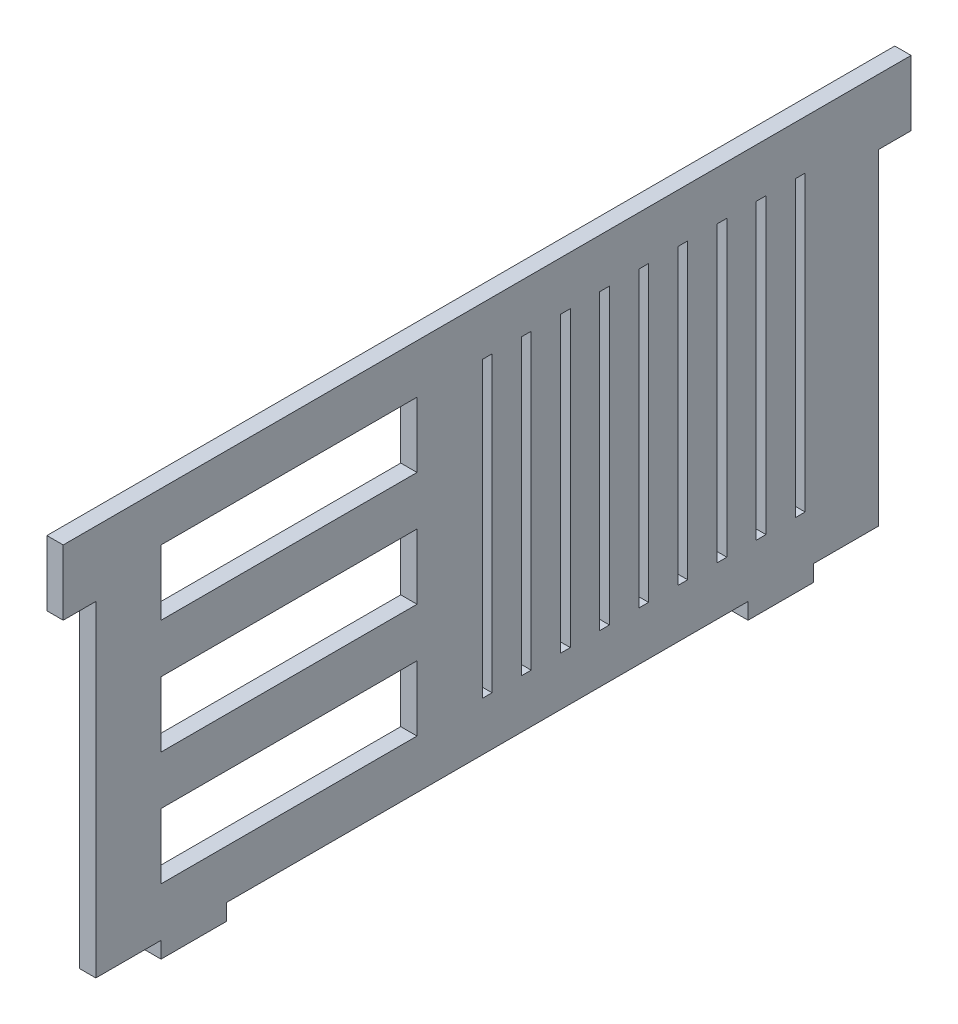
from build123d import *

# Parameters (mm, degrees)
SKIZZE2_W                       = 240
SKIZZE2_H                       = 120
SKIZZE2_W_2                     = 10
SKIZZE2_H_2                     = 20
SKIZZE2_W_3                     = 20
SKIZZE2_H_3                     = 5
AUFSATZ_LINEAR_AUSTRAGEN1_DEPTH = 5
SKIZZE3_W                       = 3
SKIZZE3_H                       = 90
SCHNITT_LINEAR_AUSTRAGEN1_DEPTH = 146.430395722
LINEARES_MUSTER1_COUNT          = 9
LINEARES_MUSTER1_PITCH          = 12
SKIZZE4_W                       = 78.5
SKIZZE4_H                       = 20
SCHNITT_LINEAR_AUSTRAGEN2_DEPTH = 146.430395722


with BuildPart() as part:
    # Skizze2 → Aufsatz-Linear austragen1 (new body)
    with BuildSketch(Plane(origin=(0, 0, 0), x_dir=(0, 0, -1), z_dir=(1, 0, 0))):
        Rectangle(SKIZZE2_W, SKIZZE2_H)
        with Locations((-125, 50)):
            Rectangle(SKIZZE2_W_2, SKIZZE2_H_2)
        with Locations((125, 50)):
            Rectangle(SKIZZE2_W_2, SKIZZE2_H_2)
        with Locations((-90, -62.5)):
            Rectangle(SKIZZE2_W_3, SKIZZE2_H_3)
        with Locations((90, -62.5)):
            Rectangle(SKIZZE2_W_3, SKIZZE2_H_3)
    extrude(amount=AUFSATZ_LINEAR_AUSTRAGEN1_DEPTH)

    # Skizze3 → Schnitt-Linear austragen1 (cut, through all)
    with BuildSketch(Plane.ZY):
        Rectangle(SKIZZE3_W, SKIZZE3_H)
    schnitt_linear_austragen1 = extrude(amount=-SCHNITT_LINEAR_AUSTRAGEN1_DEPTH, mode=Mode.SUBTRACT)

    # Lineares Muster1: Schnitt-Linear austragen1 ×9
    with Locations(*[(0, 0, -i * LINEARES_MUSTER1_PITCH) for i in range(1, LINEARES_MUSTER1_COUNT)]):
        add(schnitt_linear_austragen1, mode=Mode.SUBTRACT)

    # Skizze4 → Schnitt-Linear austragen2 (cut, through all)
    with BuildSketch(Plane.ZY):
        with Locations((60.75, 0)):
            Rectangle(SKIZZE4_W, SKIZZE4_H)
        with Locations((60.75, -35)):
            Rectangle(SKIZZE4_W, SKIZZE4_H)
        with Locations((60.75, 35)):
            Rectangle(SKIZZE4_W, SKIZZE4_H)
    extrude(amount=-SCHNITT_LINEAR_AUSTRAGEN2_DEPTH, mode=Mode.SUBTRACT)


solid = part.part
